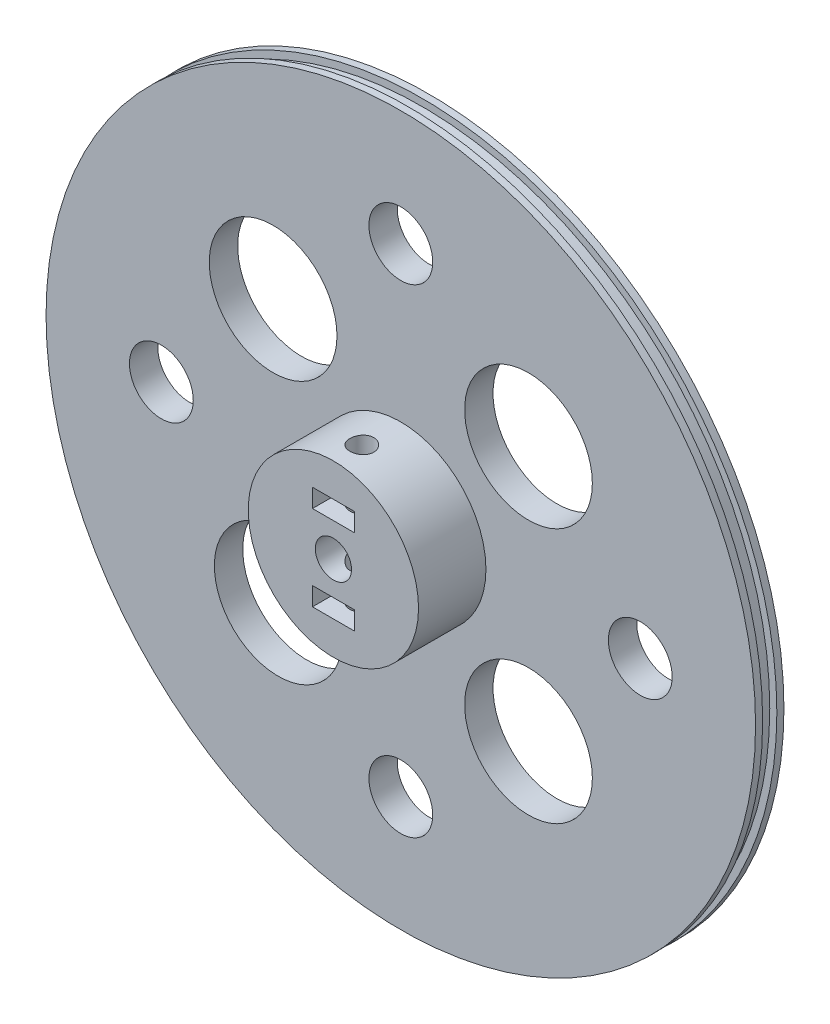
from build123d import *

# Parameters (mm, degrees)
SKETCH2_R               = 2.55
CUT_EXTRUDE1_DEPTH      = 36
SKETCH3_W               = 5.9
SKETCH3_H               = 2.6
CUT_EXTRUDE2_DEPTH      = 11
SKETCH4_R               = 4.5
SKETCH4_R_2             = 9
CUT_EXTRUDE3_DEPTH      = 11
CUT_EXTRUDE4_DEPTH      = 61
CUT_EXTRUDE4_DEPTH_BACK = 81
SKETCH5_R               = 1.682339559


with BuildPart() as part:
    # Sketch1 → Revolve2 (revolve)
    with BuildSketch(Plane(origin=(0, 0, 0), x_dir=(0, 0, -1), z_dir=(1, 0, 0)), mode=Mode.PRIVATE) as revolve2_sk:
        Polygon((0, 0), (0, 50), (-1, 50), (-1, 49), (-3, 49), (-3, 50), (-4, 50), (-4, 12), (-13.5, 12), (-13.5, 0), align=None)
    revolve(revolve2_sk.sketch.rotate(Axis((0, 0, 13.5), (0, 0, -1)), 90), axis=Axis((0, 0, 13.5), (0, 0, -1)))

    # Sketch2 → Cut-Extrude1 (cut)
    with BuildSketch(Plane.XY.offset(13.5)):
        Circle(SKETCH2_R)
    extrude(amount=-CUT_EXTRUDE1_DEPTH, mode=Mode.SUBTRACT)

    # Sketch3 → Cut-Extrude2 (cut)
    with BuildSketch(Plane.XY.offset(13.5)):
        with Locations((0, 6)):
            Rectangle(SKETCH3_W, SKETCH3_H)
        with Locations((0, -6)):
            Rectangle(SKETCH3_W, SKETCH3_H)
    extrude(amount=-CUT_EXTRUDE2_DEPTH, mode=Mode.SUBTRACT)

    # Sketch4 → Cut-Extrude3 (cut)
    with BuildSketch(Plane.XY.offset(4)):
        with Locations((0, 33.75)):
            Circle(SKETCH4_R)
        with Locations((0, -33.75)):
            Circle(SKETCH4_R)
        with Locations((33.75, 0)):
            Circle(SKETCH4_R)
        with Locations((-33.75, 0)):
            Circle(SKETCH4_R)
        with Locations((-17.995867581, 17.995867581)):
            Circle(SKETCH4_R_2)
        with Locations((17.995867581, 17.995867581)):
            Circle(SKETCH4_R_2)
        with Locations((17.995867581, -17.995867581)):
            Circle(SKETCH4_R_2)
        with Locations((-17.27525282, -18.688716917)):
            Circle(SKETCH4_R_2)
    extrude(amount=-CUT_EXTRUDE3_DEPTH, mode=Mode.SUBTRACT)

    # Sketch5 → Cut-Extrude4 (cut, two sides: drawn at the far end of the back side and taken through both)
    with BuildSketch(Plane(origin=(0, 4.7, 0), x_dir=(1, 0, 0), z_dir=(0, 1, 0)).offset(-CUT_EXTRUDE4_DEPTH_BACK)):
        with Locations(Location((0, -9.5, 0), (0, 0, 90))):
            Circle(SKETCH5_R)
    extrude(amount=CUT_EXTRUDE4_DEPTH + CUT_EXTRUDE4_DEPTH_BACK, mode=Mode.SUBTRACT)


solid = part.part
